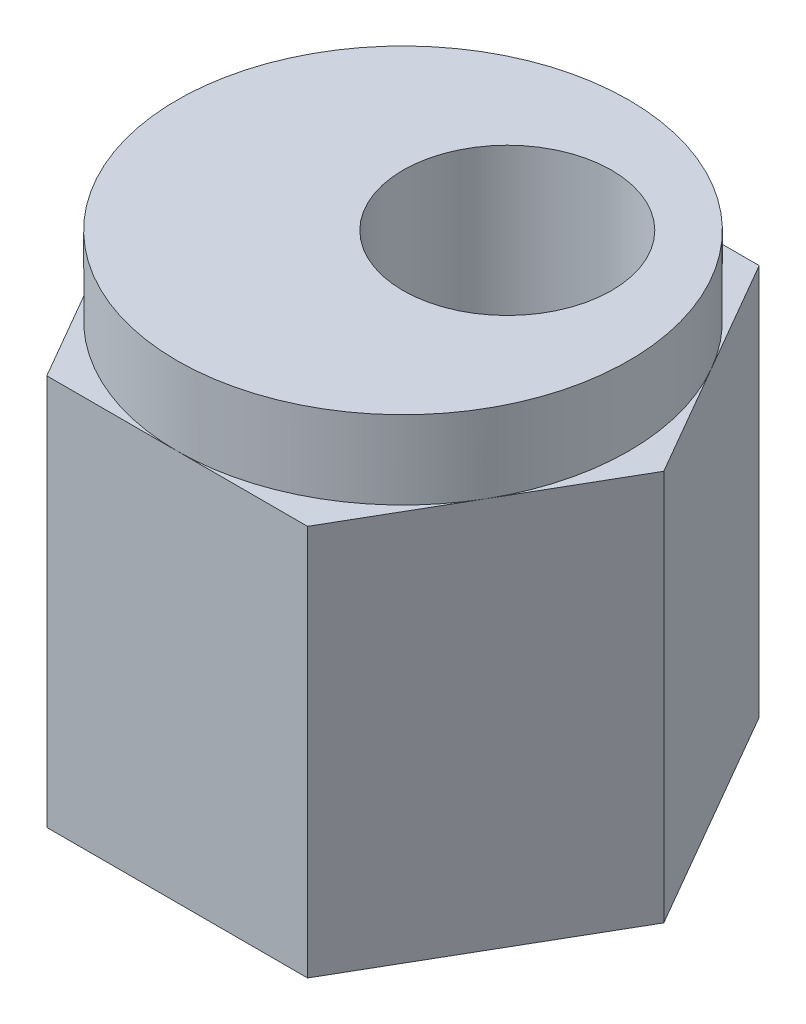
from build123d import *

# Parameters (mm, degrees)
SKETCH1_R           = 4
BOSS_EXTRUDE1_DEPTH = 18
SKETCH3_R           = 13.976554855
SKETCH3_R_2         = 8.660254038
CUT_EXTRUDE1_DEPTH  = 3


with BuildPart() as part:
    # Sketch1 → Boss-Extrude1 (new body)
    with BuildSketch(Plane(origin=(0, 0, 0), x_dir=(1, 0, 0), z_dir=(0, 1, 0))):
        Polygon((10, 0), (5, 8.660254038), (-5, 8.660254038), (-10, 0), (-5, -8.660254038), (5, -8.660254038), align=None)
        with Locations(Location((2, 2, 0), (0, 0, 270))):
            Circle(SKETCH1_R, mode=Mode.SUBTRACT)
    extrude(amount=BOSS_EXTRUDE1_DEPTH)

    # Sketch3 → Cut-Extrude1 (cut)
    with BuildSketch(Plane(origin=(0, 18, 0), x_dir=(1, 0, 0), z_dir=(0, 1, 0))):
        Circle(SKETCH3_R)
        with Locations(Location((0, 0, 0), (0, 0, 270))):
            Circle(SKETCH3_R_2, mode=Mode.SUBTRACT)
    extrude(amount=-CUT_EXTRUDE1_DEPTH, mode=Mode.SUBTRACT)


solid = part.part
